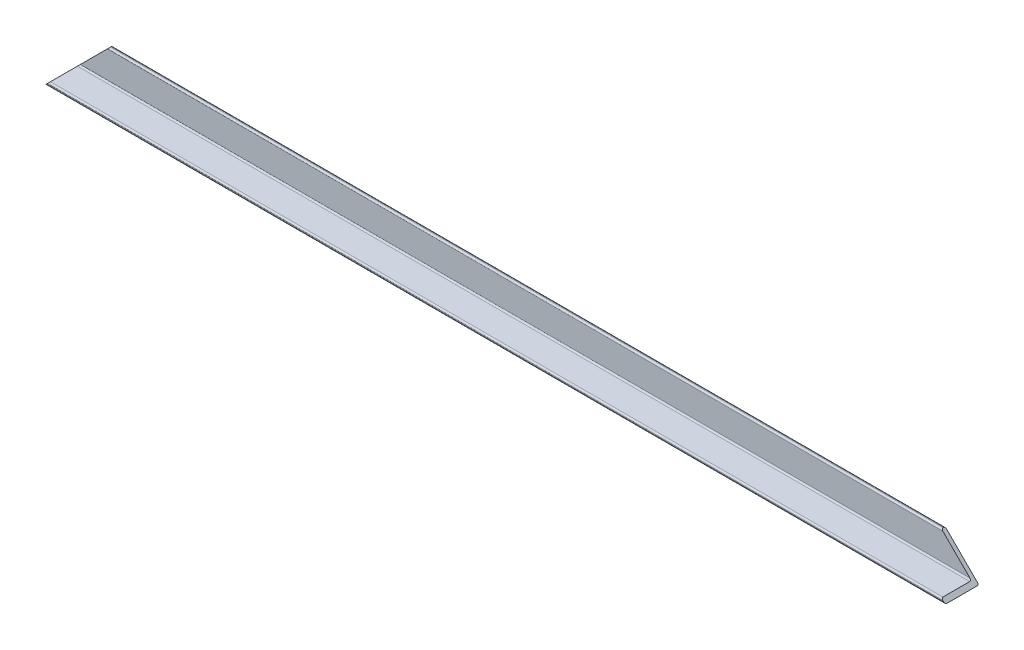
from build123d import *

# Parameters (mm, degrees)
SKETCH1_W               = 615
SKETCH1_H               = 22.5
BOSS_EXTRUDE1_DEPTH     = 2.5
SKETCH2_W               = 615
SKETCH2_H               = 2.5
BOSS_EXTRUDE2_DEPTH     = 20
CUT_EXTRUDE1_DEPTH      = 309.970063275
CUT_EXTRUDE1_DEPTH_BACK = 25
FILLET2_R               = 1


with BuildPart() as part:
    # Sketch1 → Boss-Extrude1 (new body)
    with BuildSketch(Plane(origin=(0, 0, 0), x_dir=(1, 0, 0), z_dir=(0, 1, 0))):
        Rectangle(SKETCH1_W, SKETCH1_H)
    extrude(amount=BOSS_EXTRUDE1_DEPTH)

    # Sketch2 → Boss-Extrude2 (add)
    with BuildSketch(Plane(origin=(0, 2.5, 0), x_dir=(1, 0, 0), z_dir=(0, 1, 0))):
        with Locations((0, 10)):
            Rectangle(SKETCH2_W, SKETCH2_H)
    extrude(amount=BOSS_EXTRUDE2_DEPTH)

    # Sketch3 → Cut-Extrude1 (cut, two sides: drawn at the far end of the back side and taken through both)
    with BuildSketch(Plane.XY.offset(-8.75).offset(-CUT_EXTRUDE1_DEPTH_BACK)):
        Polygon((-307.5, 22.5), (-307.5, -7.5), (-277.5, 22.5), align=None)
        Polygon((307.5, 22.5), (307.5, -7.5), (277.5, 22.5), align=None)
    extrude(amount=CUT_EXTRUDE1_DEPTH + CUT_EXTRUDE1_DEPTH_BACK, mode=Mode.SUBTRACT)

    # Fillet2
    fillet2_edges = [part.edges().sort_by_distance(p)[0] for p in [
        (0, 22.5, -8.75),
        (0, 2.5, -8.75),
        (0, 0, 11.25),
        (0, 2.5, 11.25),
        (0, 22.5, -11.25),
        (0, 0, -11.25),
    ]]
    fillet(fillet2_edges, radius=FILLET2_R)


solid = part.part
